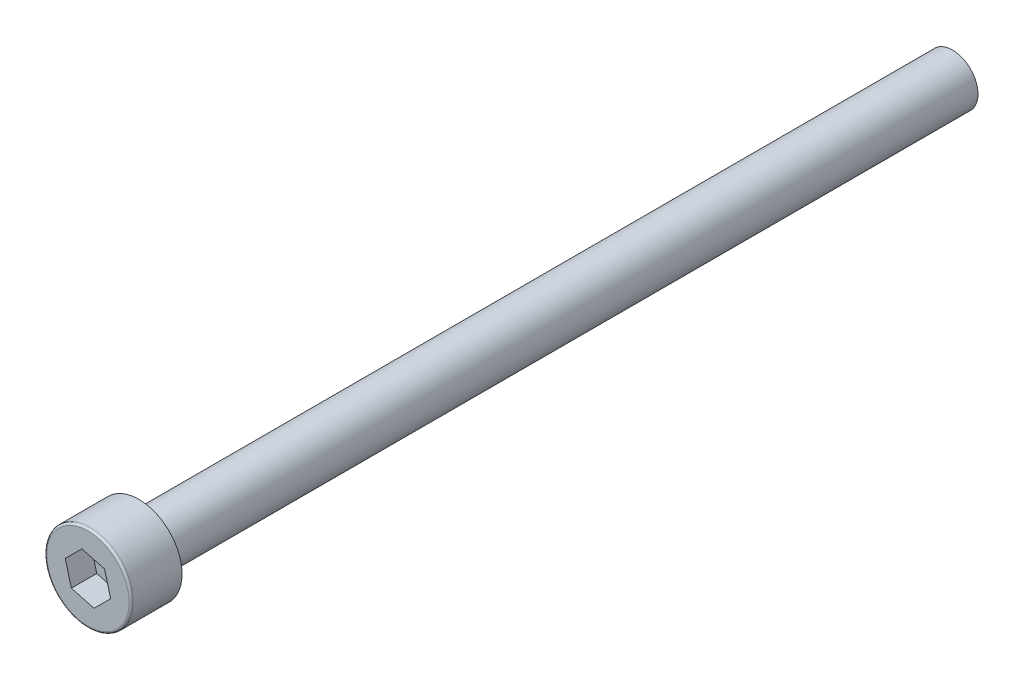
from build123d import *

# Parameters (mm, degrees)
SKETCH_1_R          = 4.25
EXTRUDE_1_DEPTH     = 5
CUT_EXTRUDE_1_DEPTH = 2.5
SKETCH_3_R          = 2.5
EXTRUDE_2_DEPTH     = 80
FILLET_1_R          = 0.2


with BuildPart() as part:
    # 草图1 → 凸台-拉伸1 (new body)
    with BuildSketch(Plane.XY):
        Circle(SKETCH_1_R)
    extrude(amount=EXTRUDE_1_DEPTH)

    # 草图2 → 切除-拉伸1 (cut)
    with BuildSketch(Plane.XY.offset(5)):
        Polygon((-1.632993162, -1.632993162), (0.597716981, -2.230710143), (2.230710143, -0.597716981), (1.632993162, 1.632993162), (-0.597716981, 2.230710143), (-2.230710143, 0.597716981), align=None)
    extrude(amount=-CUT_EXTRUDE_1_DEPTH, mode=Mode.SUBTRACT)

    # 草图3 → 凸台-拉伸2 (add)
    with BuildSketch(Plane(origin=(0, 0, 0), x_dir=(-1, 0, 0), z_dir=(0, 0, -1))):
        with Locations(Location((0, 0, 0), (0, 0, 180))):
            Circle(SKETCH_3_R)
    extrude(amount=EXTRUDE_2_DEPTH)

    # 圆角1
    fillet_1_edges = [part.edges().sort_by_distance(p)[0] for p in [
        (-4.25, 0, 5),
    ]]
    fillet(fillet_1_edges, radius=FILLET_1_R)


solid = part.part
